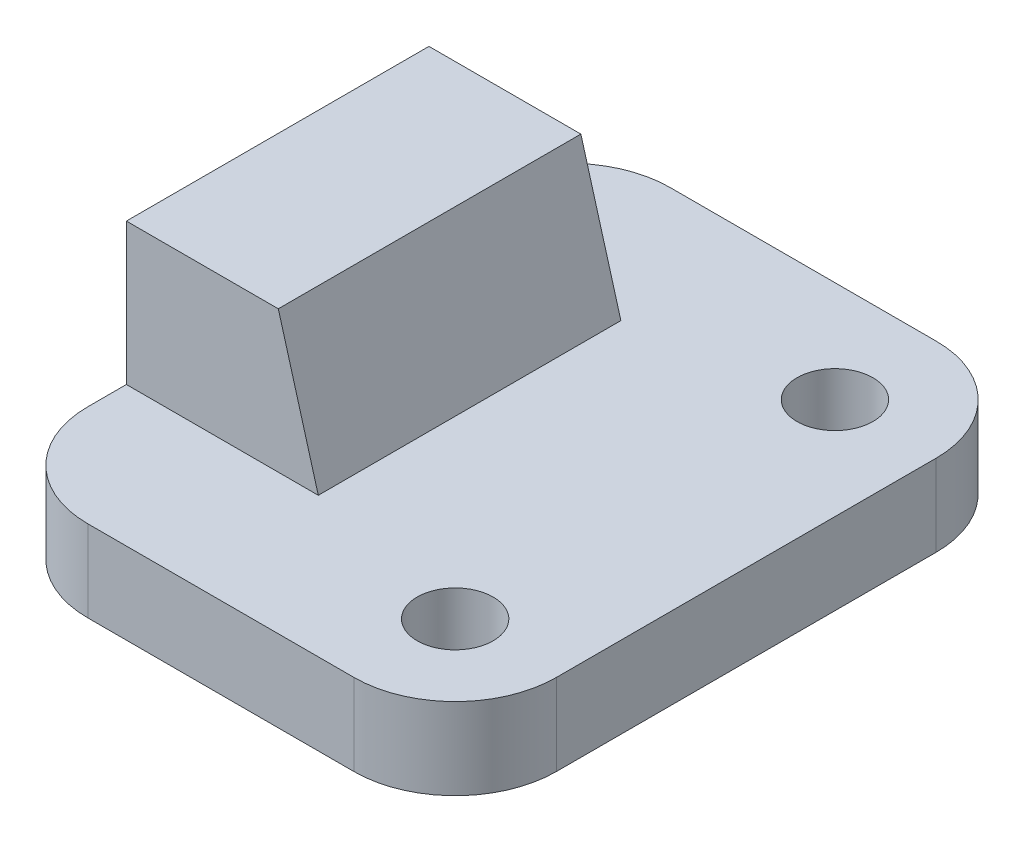
from build123d import *

# Parameters (mm, degrees)
SKETCH1_R           = 1.5
BOSS_EXTRUDE1_DEPTH = 3.22
SKETCH3_W           = 6
SKETCH3_H           = 11.95
BOSS_EXTRUDE2_DEPTH = 5.59
BOSS_EXTRUDE3_DEPTH = 11.95


with BuildPart() as part:
    # Sketch1 → Boss-Extrude1 (new body)
    with BuildSketch(Plane(origin=(0, 0, 0), x_dir=(1, 0, 0), z_dir=(0, 1, 0))):
        with BuildLine():
            Line((4, 0), (14.51, 0))
            ThreePointArc((14.51, 0), (17.338427125, 1.171572875), (18.51, 4))
            Line((18.51, 4), (18.51, 19))
            ThreePointArc((18.51, 19), (17.338427125, 21.828427125), (14.51, 23))
            Line((14.51, 23), (4, 23))
            ThreePointArc((4, 23), (1.171572875, 21.828427125), (0, 19))
            Line((0, 19), (0, 4))
            ThreePointArc((0, 4), (1.171572875, 1.171572875), (4, 0))
        make_face()
        with Locations(Location((14.51, 19, 0), (0, 0, 90))):
            Circle(SKETCH1_R, mode=Mode.SUBTRACT)
        with Locations(Location((14.51, 4, 0), (0, 0, 90))):
            Circle(SKETCH1_R, mode=Mode.SUBTRACT)
    extrude(amount=BOSS_EXTRUDE1_DEPTH)

    # Sketch3 → Boss-Extrude2 (add)
    with BuildSketch(Plane(origin=(0, 3.22, 0), x_dir=(1, 0, 0), z_dir=(0, 1, 0))):
        with Locations((3, 11.5)):
            Rectangle(SKETCH3_W, SKETCH3_H)
    extrude(amount=BOSS_EXTRUDE2_DEPTH)

    # Sketch4 → Boss-Extrude3 (add)
    with BuildSketch(Plane.XY.offset(-5.525)):
        Polygon((0, 3.22), (7.58, 3.22), (6, 8.81), (0, 8.81), align=None)
    extrude(amount=-BOSS_EXTRUDE3_DEPTH)


solid = part.part
